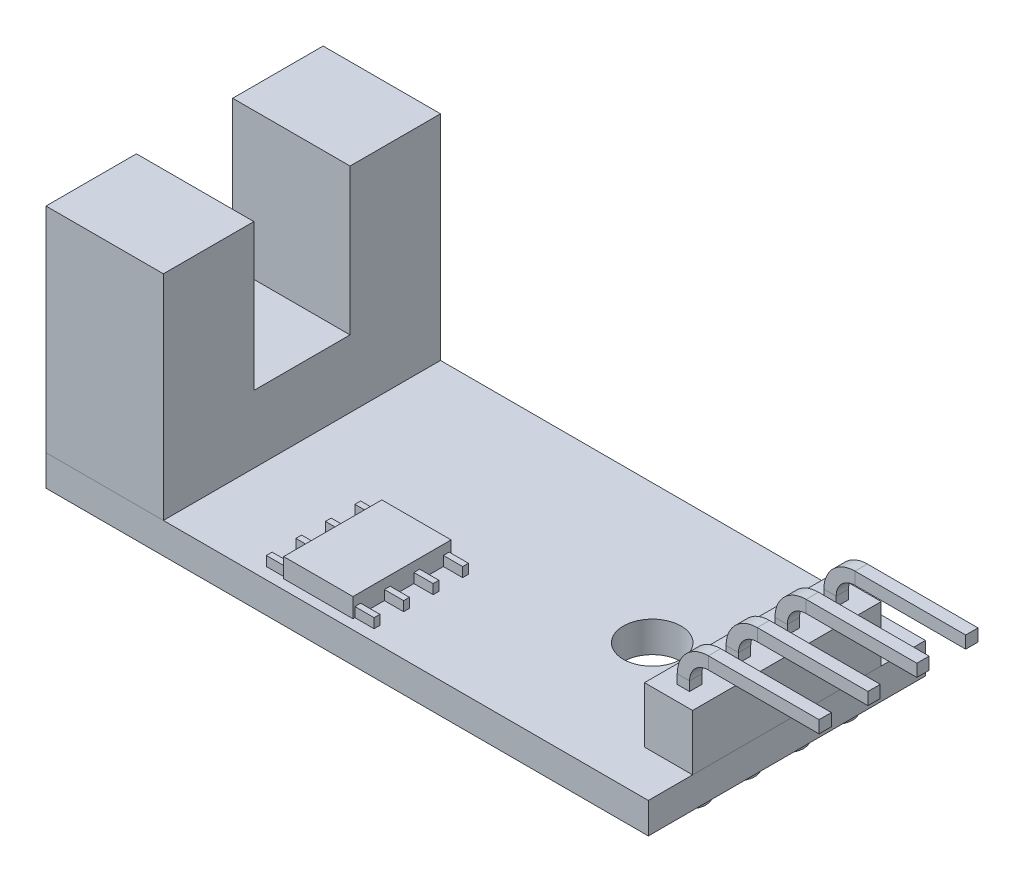
from build123d import *

# Parameters (mm, degrees)
CROQUIS1_W              = 31.3
CROQUIS1_H              = 14.4
CROQUIS1_R              = 1.5
BASE_DEPTH              = 1.6
CROQUIS2_W              = 2.5
CROQUIS2_H              = 9.8
BASE_PINES_DEPTH        = 2.9
SECCION_W               = 0.64
SECCION_H               = 0.64
MATRIZL1_COUNT          = 4
MATRIZL1_PITCH          = 2.54
CROQUIS5_W              = 6.1
CROQUIS5_H              = 14.4
CUERPO_SENSOR_DEPTH     = 11.1
CROQUIS6_W              = 6.1
CROQUIS6_H              = 5
AGUJERO_SENSOR_DEPTH    = 7.6
CROQUIS7_W              = 3.6
CROQUIS7_H              = 5.1
SALIENTE_EXTRUIR4_DEPTH = 1
CROQUIS8_W              = 1
CROQUIS8_H              = 0.3
SALIENTE_EXTRUIR5_DEPTH = 0.5
CROQUIS9_R              = 0.85
SALIENTE_EXTRUIR6_DEPTH = 0.5


with BuildPart() as part:
    # Croquis1 → BASE (new body)
    with BuildSketch(Plane(origin=(0, 0, 0), x_dir=(1, 0, 0), z_dir=(0, 1, 0))):
        Rectangle(CROQUIS1_W, CROQUIS1_H)
        with Locations(Location((8.65, 0, 0), (0, 0, 270))):
            Circle(CROQUIS1_R, mode=Mode.SUBTRACT)
    extrude(amount=BASE_DEPTH)

    # Croquis9 → Saliente-Extruir6 (add)
    with BuildSketch(Plane.XZ):
        with Locations(Location((-13.15, 5.15, 0), (0, 0, 270))):
            Circle(CROQUIS9_R)
        with Locations(Location((-10.575, 5.15, 0), (0, 0, 270))):
            Circle(CROQUIS9_R)
        with Locations(Location((-10.575, 2.575, 0), (0, 0, 270))):
            Circle(CROQUIS9_R)
        with Locations(Location((-13.15, 2.575, 0), (0, 0, 270))):
            Circle(CROQUIS9_R)
        with Locations(Location((-13.15, 0, 0), (0, 0, 270))):
            Circle(CROQUIS9_R)
        with Locations(Location((-13.15, -2.575, 0), (0, 0, 270))):
            Circle(CROQUIS9_R)
        with Locations(Location((-13.15, -5.15, 0), (0, 0, 270))):
            Circle(CROQUIS9_R)
        with Locations(Location((-10.575, -5.15, 0), (0, 0, 270))):
            Circle(CROQUIS9_R)
        with Locations(Location((-10.575, -2.575, 0), (0, 0, 270))):
            Circle(CROQUIS9_R)
        with Locations(Location((14.4, 3.81, 0), (0, 0, 270))):
            Circle(CROQUIS9_R)
        with Locations(Location((14.4, 1.27, 0), (0, 0, 270))):
            Circle(CROQUIS9_R)
        with Locations(Location((14.4, -1.27, 0), (0, 0, 270))):
            Circle(CROQUIS9_R)
        with Locations(Location((14.4, -3.81, 0), (0, 0, 270))):
            Circle(CROQUIS9_R)
    extrude(amount=SALIENTE_EXTRUIR6_DEPTH)


with BuildPart() as body_2:
    # Croquis2 → BASE PINES (new body)
    with BuildSketch(Plane(origin=(0, 1.6, 0), x_dir=(1, 0, 0), z_dir=(0, 1, 0))):
        with Locations((14.4, 0)):
            Rectangle(CROQUIS2_W, CROQUIS2_H)
    extrude(amount=BASE_PINES_DEPTH)


with BuildPart() as body_3:
    # PIN Vcc: sweep along a path in DIRECTRIZ
    with BuildLine(Plane.XY.offset(-3.81)) as pin_vcc_path:
        Line((14.4, 4.5), (14.4, 4.98))
        ThreePointArc((14.4, 4.98), (14.780761184, 5.899238816), (15.7, 6.28))
        Line((15.7, 6.28), (21.45, 6.28))
    # SECCION → PIN Vcc (sweep)
    with BuildSketch(Plane(origin=(0, 4.5, 0), x_dir=(1, 0, 0), z_dir=(0, 1, 0))):
        with Locations((14.4, 3.81)):
            Rectangle(SECCION_W, SECCION_H)
    sweep(path=pin_vcc_path.line)


with BuildPart() as matrizl1_1:
    # MatrizL1: pattern copy
    add(body_3.part.moved(Location(Vector(0, 0, 1) * (1 * MATRIZL1_PITCH))))


with BuildPart() as matrizl1_2:
    # MatrizL1: pattern copy
    add(body_3.part.moved(Location(Vector(0, 0, 1) * (2 * MATRIZL1_PITCH))))


with BuildPart() as matrizl1_3:
    # MatrizL1: pattern copy
    add(body_3.part.moved(Location(Vector(0, 0, 1) * (3 * MATRIZL1_PITCH))))


with BuildPart() as body_7:
    # Croquis5 → CUERPO SENSOR (new body)
    with BuildSketch(Plane(origin=(0, 1.6, 0), x_dir=(1, 0, 0), z_dir=(0, 1, 0))):
        with Locations((-12.6, 0)):
            Rectangle(CROQUIS5_W, CROQUIS5_H)
    extrude(amount=CUERPO_SENSOR_DEPTH)

    # Croquis6 → AGUJERO SENSOR (cut)
    with BuildSketch(Plane(origin=(0, 12.7, 0), x_dir=(1, 0, 0), z_dir=(0, 1, 0))):
        with Locations((-12.6, 0)):
            Rectangle(CROQUIS6_W, CROQUIS6_H)
    extrude(amount=-AGUJERO_SENSOR_DEPTH, mode=Mode.SUBTRACT)


with BuildPart() as body_8:
    # Croquis7 → Saliente-Extruir4 (new body)
    with BuildSketch(Plane(origin=(0, 1.6, 0), x_dir=(1, 0, 0), z_dir=(0, 1, 0))):
        with Locations((-2, -4.15)):
            Rectangle(CROQUIS7_W, CROQUIS7_H)
    extrude(amount=SALIENTE_EXTRUIR4_DEPTH)

    # Croquis8 → Saliente-Extruir5 (add)
    with BuildSketch(Plane(origin=(0, 1.6, 0), x_dir=(1, 0, 0), z_dir=(0, 1, 0))):
        with Locations((-4.3, -1.85)):
            Rectangle(CROQUIS8_W, CROQUIS8_H)
        with Locations((-4.3, -3.383333333)):
            Rectangle(CROQUIS8_W, CROQUIS8_H)
        with Locations((-4.3, -4.916666667)):
            Rectangle(CROQUIS8_W, CROQUIS8_H)
        with Locations((-4.3, -6.45)):
            Rectangle(CROQUIS8_W, CROQUIS8_H)
        with Locations((0.3, -1.85)):
            Rectangle(CROQUIS8_W, CROQUIS8_H)
        with Locations((0.3, -3.383333333)):
            Rectangle(CROQUIS8_W, CROQUIS8_H)
        with Locations((0.3, -4.916666667)):
            Rectangle(CROQUIS8_W, CROQUIS8_H)
        with Locations((0.3, -6.45)):
            Rectangle(CROQUIS8_W, CROQUIS8_H)
    extrude(amount=SALIENTE_EXTRUIR5_DEPTH)


solid = Compound([part.part, body_2.part, body_3.part, matrizl1_1.part, matrizl1_2.part, matrizl1_3.part, body_7.part, body_8.part])
